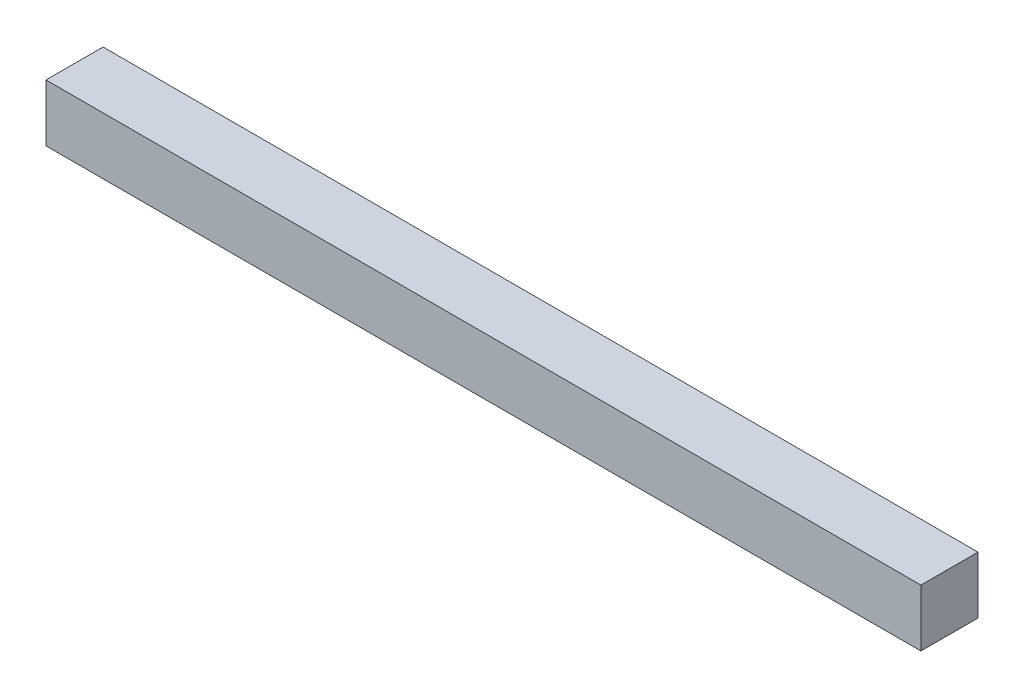
from build123d import *

# Parameters (mm, degrees)
SKETCH1_W           = 14.99997
SKETCH1_H           = 14.99997
BOSS_EXTRUDE1_DEPTH = 229.89794


with BuildPart() as part:
    # Sketch1 → Boss-Extrude1 (new body)
    with BuildSketch(Plane(origin=(0, 0, 0), x_dir=(0, 0, -1), z_dir=(1, 0, 0))):
        with Locations((7.499985, 7.499985)):
            Rectangle(SKETCH1_W, SKETCH1_H)
    extrude(amount=BOSS_EXTRUDE1_DEPTH)


solid = part.part
